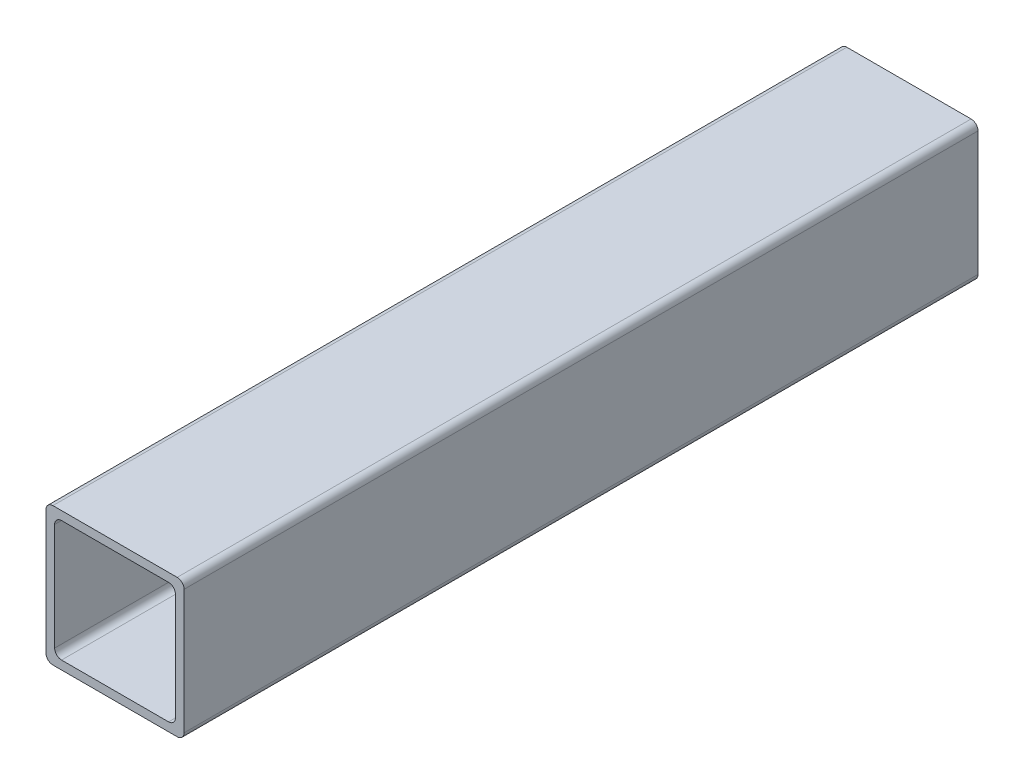
from build123d import *

# Parameters (mm, degrees)
BOSS_EXTRUDE1_DEPTH = 146.05


with BuildPart() as part:
    # Sketch1 → Boss-Extrude1 (new, symmetric)
    with BuildSketch(Plane.XY):
        with BuildLine():
            Line((-22.86, -25.4), (22.86, -25.4))
            ThreePointArc((22.86, -25.4), (24.656051224, -24.656051224), (25.4, -22.86))
            Line((25.4, -22.86), (25.4, 22.86))
            ThreePointArc((25.4, 22.86), (24.656051224, 24.656051224), (22.86, 25.4))
            Line((22.86, 25.4), (-22.86, 25.4))
            ThreePointArc((-22.86, 25.4), (-24.656051224, 24.656051224), (-25.4, 22.86))
            Line((-25.4, 22.86), (-25.4, -22.86))
            ThreePointArc((-25.4, -22.86), (-24.656051224, -24.656051224), (-22.86, -25.4))
        make_face()
        with BuildLine():
            Line((-19.685, 22.225), (19.685, 22.225))
            ThreePointArc((19.685, 22.225), (21.481051224, 21.481051224), (22.225, 19.685))
            Line((22.225, 19.685), (22.225, -19.685))
            ThreePointArc((22.225, -19.685), (21.481051224, -21.481051224), (19.685, -22.225))
            Line((19.685, -22.225), (-19.685, -22.225))
            ThreePointArc((-19.685, -22.225), (-21.481051224, -21.481051224), (-22.225, -19.685))
            Line((-22.225, -19.685), (-22.225, 19.685))
            ThreePointArc((-22.225, 19.685), (-21.481051224, 21.481051224), (-19.685, 22.225))
        make_face(mode=Mode.SUBTRACT)
    extrude(amount=BOSS_EXTRUDE1_DEPTH, both=True)


solid = part.part
